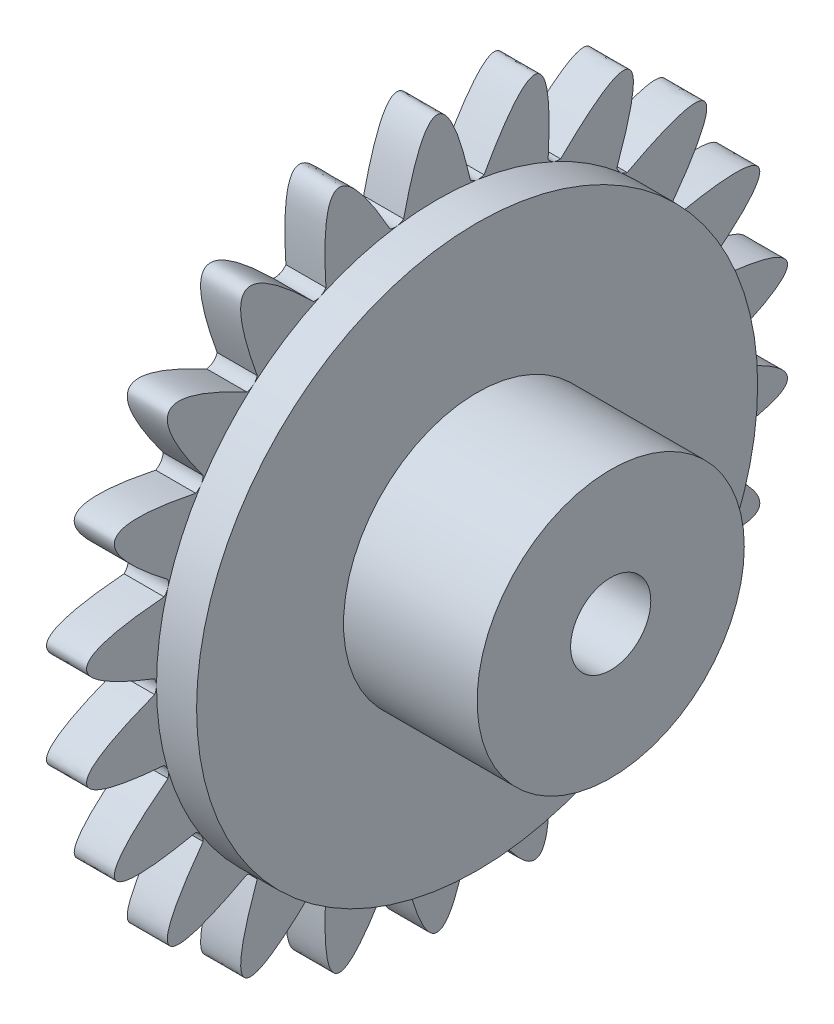
from build123d import *

# Parameters (mm, degrees)
SKETCH1_R           = 21
BOSS_EXTRUDE1_DEPTH = 3
SKETCH2_R           = 10
BOSS_EXTRUDE2_DEPTH = 10
SKETCH3_R           = 3
CUT_EXTRUDE1_DEPTH  = 10
BOSS_EXTRUDE3_DEPTH = 3


with BuildPart() as part:
    # Sketch1 → Boss-Extrude1 (new body)
    with BuildSketch(Plane(origin=(0, 0, 0), x_dir=(0, 0, -1), z_dir=(1, 0, 0))):
        Circle(SKETCH1_R)
    extrude(amount=BOSS_EXTRUDE1_DEPTH)

    # Sketch2 → Boss-Extrude2 (add)
    with BuildSketch(Plane(origin=(3, 0, 0), x_dir=(0, 0, -1), z_dir=(1, 0, 0))):
        Circle(SKETCH2_R)
    extrude(amount=BOSS_EXTRUDE2_DEPTH)

    # Sketch3 → Cut-Extrude1 (cut)
    with BuildSketch(Plane(origin=(13, 0, 0), x_dir=(0, 0, -1), z_dir=(1, 0, 0))):
        Circle(SKETCH3_R)
    extrude(amount=-CUT_EXTRUDE1_DEPTH, mode=Mode.SUBTRACT)

    # Sketch4 → Boss-Extrude3 (add)
    with BuildSketch(Plane.ZY):
        with BuildLine():
            add(Edge.make_bspline(
                [(-2.5, 21), (0, 32), (2.5, 21)],
                knots=[0, 0, 0, 1, 1, 1], degree=2))
            add(Edge.make_bspline(
                [(2.5, 21), (2.969469847, 20.645446152), (3.51765126, 20.853683838)],
                knots=[0, 0, 0, 1, 1, 1], degree=2))
            add(Edge.make_bspline(
                [(3.51765126, 20.853683838), (9.015441819, 30.703775156), (8.315116128, 19.445021054)],
                knots=[0, 0, 0, 1, 1, 1], degree=2))
            add(Edge.make_bspline(
                [(8.315116128, 19.445021054), (8.665679785, 18.972564188), (9.250323334, 19.017926233)],
                knots=[0, 0, 0, 1, 1, 1], degree=2))
            add(Edge.make_bspline(
                [(9.250323334, 19.017926233), (17.300506159, 26.920113051), (13.456590999, 16.314722146)],
                knots=[0, 0, 0, 1, 1, 1], degree=2))
            add(Edge.make_bspline(
                [(13.456590999, 16.314722146), (13.659847884, 15.762637907), (14.233589227, 15.641449349)],
                knots=[0, 0, 0, 1, 1, 1], degree=2))
            add(Edge.make_bspline(
                [(14.233589227, 15.641449349), (24.183986379, 20.955543486), (17.507892896, 11.862701477)],
                knots=[0, 0, 0, 1, 1, 1], degree=2))
            add(Edge.make_bspline(
                [(17.507892896, 11.862701477), (17.547376346, 11.275716447), (18.06373437, 10.997795261)],
                knots=[0, 0, 0, 1, 1, 1], degree=2))
            add(Edge.make_bspline(
                [(18.06373437, 10.997795261), (29.108223851, 13.293280416), (20.140809435, 6.449635285)],
                knots=[0, 0, 0, 1, 1, 1], degree=2))
            add(Edge.make_bspline(
                [(20.140809435, 6.449635285), (20.013320734, 5.8753035), (20.430463184, 5.463165208)],
                knots=[0, 0, 0, 1, 1, 1], degree=2))
            add(Edge.make_bspline(
                [(20.430463184, 5.463165208), (31.67428614, 4.554074825), (21.142037375, 0.514057999)],
                knots=[0, 0, 0, 1, 1, 1], degree=2))
            add(Edge.make_bspline(
                [(21.142037375, 0.514057999), (20.8579049, -0.001091596), (21.142037375, -0.514057999)],
                knots=[0, 0, 0, 1, 1, 1], degree=2))
            add(Edge.make_bspline(
                [(21.142037375, -0.514057999), (31.67428614, -4.554074825), (20.430463184, -5.463165208)],
                knots=[0, 0, 0, 1, 1, 1], degree=2))
            add(Edge.make_bspline(
                [(20.430463184, -5.463165208), (20.012705658, -5.877398256), (20.140809435, -6.449635285)],
                knots=[0, 0, 0, 1, 1, 1], degree=2))
            add(Edge.make_bspline(
                [(20.140809435, -6.449635285), (29.108223851, -13.293280416), (18.06373437, -10.997795261)],
                knots=[0, 0, 0, 1, 1, 1], degree=2))
            add(Edge.make_bspline(
                [(18.06373437, -10.997795261), (17.546196023, -11.277553064), (17.507892896, -11.862701477)],
                knots=[0, 0, 0, 1, 1, 1], degree=2))
            add(Edge.make_bspline(
                [(17.507892896, -11.862701477), (24.183986379, -20.955543486), (14.233589227, -15.641449349)],
                knots=[0, 0, 0, 1, 1, 1], degree=2))
            add(Edge.make_bspline(
                [(14.233589227, -15.641449349), (13.658197938, -15.764067593), (13.456590999, -16.314722146)],
                knots=[0, 0, 0, 1, 1, 1], degree=2))
            add(Edge.make_bspline(
                [(13.456590999, -16.314722146), (17.300506159, -26.920113051), (9.250323334, -19.017926233)],
                knots=[0, 0, 0, 1, 1, 1], degree=2))
            add(Edge.make_bspline(
                [(9.250323334, -19.017926233), (8.663693885, -18.973471118), (8.315116128, -19.445021054)],
                knots=[0, 0, 0, 1, 1, 1], degree=2))
            add(Edge.make_bspline(
                [(8.315116128, -19.445021054), (9.015441819, -30.703775156), (3.51765126, -20.853683838)],
                knots=[0, 0, 0, 1, 1, 1], degree=2))
            add(Edge.make_bspline(
                [(3.51765126, -20.853683838), (2.967308878, -20.645756853), (2.5, -21)],
                knots=[0, 0, 0, 1, 1, 1], degree=2))
            add(Edge.make_bspline(
                [(2.5, -21), (0, -32), (-2.5, -21)],
                knots=[0, 0, 0, 1, 1, 1], degree=2))
            add(Edge.make_bspline(
                [(-2.5, -21), (-2.969469847, -20.645446152), (-3.51765126, -20.853683838)],
                knots=[0, 0, 0, 1, 1, 1], degree=2))
            add(Edge.make_bspline(
                [(-3.51765126, -20.853683838), (-9.015441819, -30.703775156), (-8.315116128, -19.445021054)],
                knots=[0, 0, 0, 1, 1, 1], degree=2))
            add(Edge.make_bspline(
                [(-8.315116128, -19.445021054), (-8.665679785, -18.972564188), (-9.250323334, -19.017926233)],
                knots=[0, 0, 0, 1, 1, 1], degree=2))
            add(Edge.make_bspline(
                [(-9.250323334, -19.017926233), (-17.300506159, -26.920113051), (-13.456590999, -16.314722146)],
                knots=[0, 0, 0, 1, 1, 1], degree=2))
            add(Edge.make_bspline(
                [(-13.456590999, -16.314722146), (-13.659847884, -15.762637907), (-14.233589227, -15.641449349)],
                knots=[0, 0, 0, 1, 1, 1], degree=2))
            add(Edge.make_bspline(
                [(-14.233589227, -15.641449349), (-24.183986379, -20.955543486), (-17.507892896, -11.862701477)],
                knots=[0, 0, 0, 1, 1, 1], degree=2))
            add(Edge.make_bspline(
                [(-17.507892896, -11.862701477), (-17.547376346, -11.275716447), (-18.06373437, -10.997795261)],
                knots=[0, 0, 0, 1, 1, 1], degree=2))
            add(Edge.make_bspline(
                [(-18.06373437, -10.997795261), (-29.108223851, -13.293280416), (-20.140809435, -6.449635285)],
                knots=[0, 0, 0, 1, 1, 1], degree=2))
            add(Edge.make_bspline(
                [(-20.140809435, -6.449635285), (-20.013320734, -5.8753035), (-20.430463184, -5.463165208)],
                knots=[0, 0, 0, 1, 1, 1], degree=2))
            add(Edge.make_bspline(
                [(-20.430463184, -5.463165208), (-31.67428614, -4.554074825), (-21.142037375, -0.514057999)],
                knots=[0, 0, 0, 1, 1, 1], degree=2))
            add(Edge.make_bspline(
                [(-21.142037375, -0.514057999), (-20.8579049, 0.001091596), (-21.142037375, 0.514057999)],
                knots=[0, 0, 0, 1, 1, 1], degree=2))
            add(Edge.make_bspline(
                [(-21.142037375, 0.514057999), (-31.67428614, 4.554074825), (-20.430463184, 5.463165208)],
                knots=[0, 0, 0, 1, 1, 1], degree=2))
            add(Edge.make_bspline(
                [(-20.430463184, 5.463165208), (-20.012705658, 5.877398256), (-20.140809435, 6.449635285)],
                knots=[0, 0, 0, 1, 1, 1], degree=2))
            add(Edge.make_bspline(
                [(-20.140809435, 6.449635285), (-29.108223851, 13.293280416), (-18.06373437, 10.997795261)],
                knots=[0, 0, 0, 1, 1, 1], degree=2))
            add(Edge.make_bspline(
                [(-18.06373437, 10.997795261), (-17.546196023, 11.277553064), (-17.507892896, 11.862701477)],
                knots=[0, 0, 0, 1, 1, 1], degree=2))
            add(Edge.make_bspline(
                [(-17.507892896, 11.862701477), (-24.183986379, 20.955543486), (-14.233589227, 15.641449349)],
                knots=[0, 0, 0, 1, 1, 1], degree=2))
            add(Edge.make_bspline(
                [(-14.233589227, 15.641449349), (-13.658197938, 15.764067593), (-13.456590999, 16.314722146)],
                knots=[0, 0, 0, 1, 1, 1], degree=2))
            add(Edge.make_bspline(
                [(-13.456590999, 16.314722146), (-17.300506159, 26.920113051), (-9.250323334, 19.017926233)],
                knots=[0, 0, 0, 1, 1, 1], degree=2))
            add(Edge.make_bspline(
                [(-9.250323334, 19.017926233), (-8.663693885, 18.973471118), (-8.315116128, 19.445021054)],
                knots=[0, 0, 0, 1, 1, 1], degree=2))
            add(Edge.make_bspline(
                [(-8.315116128, 19.445021054), (-9.015441819, 30.703775156), (-3.51765126, 20.853683838)],
                knots=[0, 0, 0, 1, 1, 1], degree=2))
            add(Edge.make_bspline(
                [(-3.51765126, 20.853683838), (-2.967308878, 20.645756853), (-2.5, 21)],
                knots=[0, 0, 0, 1, 1, 1], degree=2))
        make_face()
    extrude(amount=BOSS_EXTRUDE3_DEPTH)


solid = part.part
